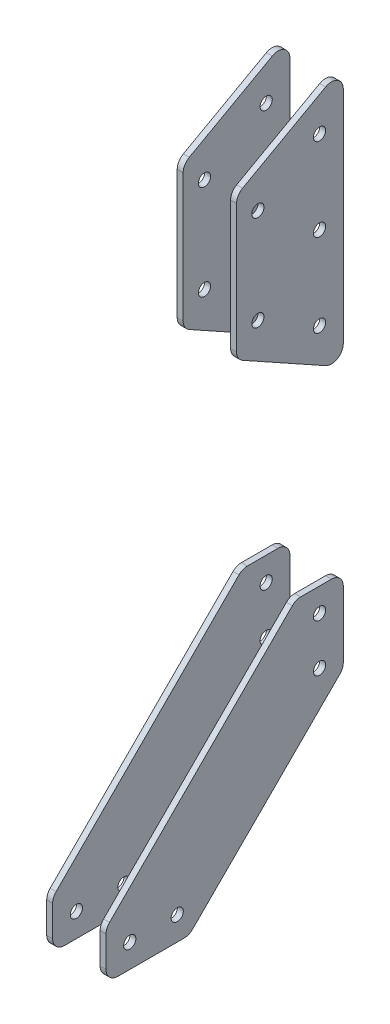
from build123d import *

# Parameters (mm, degrees)
BOSS_EXTRUDE1_DEPTH              = 3.175
BOSS_EXTRUDE1_2_DEPTH            = 3.175
SKETCH3_W                        = 3.2639
SKETCH3_H                        = 3.175
F_1_4_CLEARANCE_HOLE1_AT_2_COUNT = 2
F_1_4_CLEARANCE_HOLE1_AT_2_PITCH = 88.9
F_1_4_CLEARANCE_HOLE1_AT_3_COUNT = 2
F_1_4_CLEARANCE_HOLE1_AT_3_PITCH = 222.25
F_1_4_CLEARANCE_HOLE1_AT_4_COUNT = 2
F_1_4_CLEARANCE_HOLE1_AT_4_PITCH = 247.65
F_1_4_CLEARANCE_HOLE1_AT_5_COUNT = 2
F_1_4_CLEARANCE_HOLE1_AT_5_PITCH = 339.413291578
F_1_4_CLEARANCE_HOLE1_AT_6_COUNT = 2
F_1_4_CLEARANCE_HOLE1_AT_6_PITCH = 332.693947195
F_1_4_CLEARANCE_HOLE1_AT_7_COUNT = 2
F_1_4_CLEARANCE_HOLE1_AT_7_PITCH = 44.45
F_1_4_CLEARANCE_HOLE1_AT_8_COUNT = 2
F_1_4_CLEARANCE_HOLE1_AT_8_PITCH = 38.12116079
F_1_4_CLEARANCE_HOLE1_AT_9_COUNT = 2
F_1_4_CLEARANCE_HOLE1_AT_9_PITCH = 77.261522765
FILLET1_R                        = 6.35
FILLET2_R                        = 6.35


with BuildPart() as part:
    # Sketch1 → Boss-Extrude1 (new body)
    with BuildSketch(Plane(origin=(12.7, 0, 0), x_dir=(0, 0, -1), z_dir=(1, 0, 0))):
        Polygon((-44.45, 317.5), (-44.45, 241.3), (12.7, 209.55), (12.7, 349.25), align=None)
    extrude(amount=BOSS_EXTRUDE1_DEPTH)

    # Sketch3 → 1/4 Clearance Hole1 (revolve, cut)
    with BuildSketch(Plane(origin=(15.875, 323.85, 0), x_dir=(0, 0, -1), z_dir=(0, 1, 0))):
        with Locations((1.63195, 1.5875)):
            Rectangle(SKETCH3_W, SKETCH3_H)
    f_1_4_clearance_hole1 = revolve(axis=Axis((22.225, 323.85, 0), (-1, 0, 0)), mode=Mode.SUBTRACT)

    # 1/4 Clearance Hole1 at 2: 1/4 Clearance Hole1 ×2
    with Locations(*[(0, -i * F_1_4_CLEARANCE_HOLE1_AT_2_PITCH, 0) for i in range(1, F_1_4_CLEARANCE_HOLE1_AT_2_COUNT)]):
        add(f_1_4_clearance_hole1, mode=Mode.SUBTRACT)

    # 1/4 Clearance Hole1 at 7: 1/4 Clearance Hole1 ×2
    with Locations(*[(0, -i * F_1_4_CLEARANCE_HOLE1_AT_7_PITCH, 0) for i in range(1, F_1_4_CLEARANCE_HOLE1_AT_7_COUNT)]):
        add(f_1_4_clearance_hole1, mode=Mode.SUBTRACT)

    # 1/4 Clearance Hole1 at 8: 1/4 Clearance Hole1 ×2
    with Locations(*[Vector(0, -0.49972245348957717, 0.8661855860486004) * (i * F_1_4_CLEARANCE_HOLE1_AT_8_PITCH) for i in range(1, F_1_4_CLEARANCE_HOLE1_AT_8_COUNT)]):
        add(f_1_4_clearance_hole1, mode=Mode.SUBTRACT)

    # 1/4 Clearance Hole1 at 9: 1/4 Clearance Hole1 ×2
    with Locations(*[Vector(0, -0.9040722665053035, 0.4273796168934165) * (i * F_1_4_CLEARANCE_HOLE1_AT_9_PITCH) for i in range(1, F_1_4_CLEARANCE_HOLE1_AT_9_COUNT)]):
        add(f_1_4_clearance_hole1, mode=Mode.SUBTRACT)

    # Fillet1
    fillet1_edges = [part.edges().sort_by_distance(p)[0] for p in [
        (14.2875, 349.25, -12.7),
        (14.2875, 209.55, -12.7),
        (14.2875, 241.3, 44.45),
        (14.2875, 317.5, 44.45),
    ]]
    fillet(fillet1_edges, radius=FILLET1_R)


with BuildPart() as body_2:
    # Sketch1 → Boss-Extrude1 2 (new body)
    with BuildSketch(Plane(origin=(12.7, 0, 0), x_dir=(0, 0, -1), z_dir=(1, 0, 0))):
        Polygon((-12.7, 114.3), (-114.3, 12.7), (-114.3, -12.7), (-69.85, -12.7), (12.7, 69.85), (12.7, 114.3), align=None)
    extrude(amount=BOSS_EXTRUDE1_2_DEPTH)

    # 1/4 Clearance Hole1 at 3: 1/4 Clearance Hole1 ×2
    with Locations(*[(0, -i * F_1_4_CLEARANCE_HOLE1_AT_3_PITCH, 0) for i in range(1, F_1_4_CLEARANCE_HOLE1_AT_3_COUNT)]):
        add(f_1_4_clearance_hole1, mode=Mode.SUBTRACT)

    # 1/4 Clearance Hole1 at 4: 1/4 Clearance Hole1 ×2
    with Locations(*[(0, -i * F_1_4_CLEARANCE_HOLE1_AT_4_PITCH, 0) for i in range(1, F_1_4_CLEARANCE_HOLE1_AT_4_COUNT)]):
        add(f_1_4_clearance_hole1, mode=Mode.SUBTRACT)

    # 1/4 Clearance Hole1 at 5: 1/4 Clearance Hole1 ×2
    with Locations(*[Vector(0, -0.954146487587723, 0.29934007453732503) * (i * F_1_4_CLEARANCE_HOLE1_AT_5_PITCH) for i in range(1, F_1_4_CLEARANCE_HOLE1_AT_5_COUNT)]):
        add(f_1_4_clearance_hole1, mode=Mode.SUBTRACT)

    # 1/4 Clearance Hole1 at 6: 1/4 Clearance Hole1 ×2
    with Locations(*[Vector(0, -0.973417168333576, 0.22903933372554747) * (i * F_1_4_CLEARANCE_HOLE1_AT_6_PITCH) for i in range(1, F_1_4_CLEARANCE_HOLE1_AT_6_COUNT)]):
        add(f_1_4_clearance_hole1, mode=Mode.SUBTRACT)

    # Fillet2
    fillet2_edges = [body_2.edges().sort_by_distance(p)[0] for p in [
        (14.2875, -12.7, 114.3),
        (14.2875, 12.7, 114.3),
        (14.2875, 114.3, 12.7),
        (14.2875, 114.3, -12.7),
        (14.2875, 69.85, -12.7),
        (14.2875, -12.7, 69.85),
    ]]
    fillet(fillet2_edges, radius=FILLET2_R)


with BuildPart() as body_3:
    # Mirror1: mirrored copy
    add(part.part.mirror(Plane(origin=(0, 0, 0), x_dir=(0, 0, 1), z_dir=(1, 0, 0))))


with BuildPart() as body_4:
    # Mirror1 2: mirrored copy
    add(body_2.part.mirror(Plane(origin=(0, 0, 0), x_dir=(0, 0, 1), z_dir=(1, 0, 0))))


solid = Compound([part.part, body_2.part, body_3.part, body_4.part])
